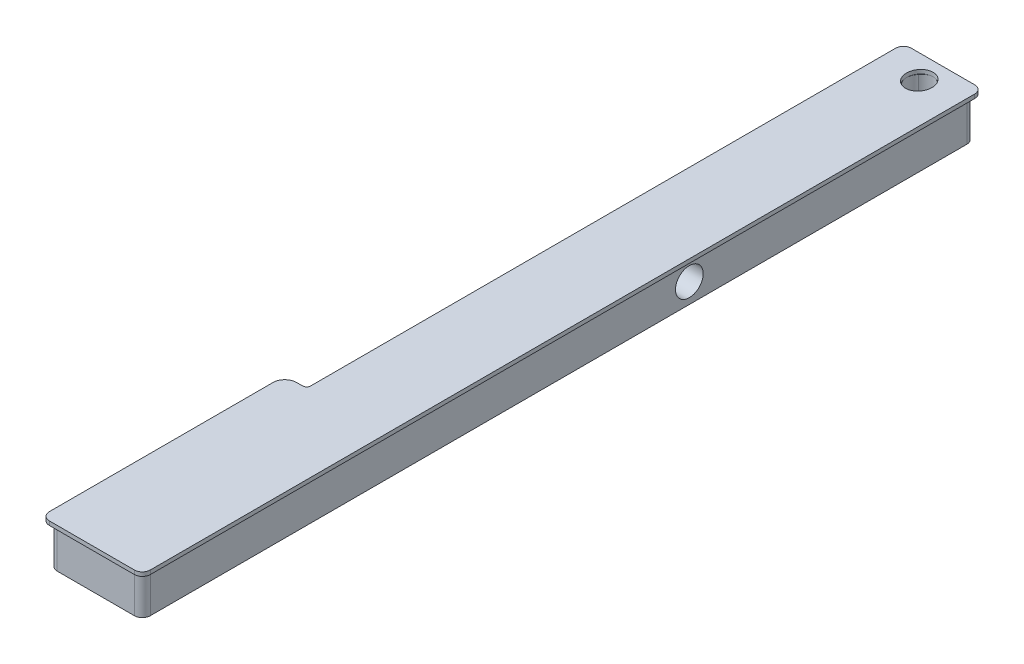
from build123d import *
from build123d.topology import SkipClean

# Parameters (mm, degrees)
BOSS_EXTRU_1_DEPTH       = 10
ESQUISSE2_RX             = 3.5
ESQUISSE2_RY             = 3
ENL_V_MAT_EXTRU_1_DEPTH  = 10
ESQUISSE3_R              = 3.2
ENL_V_MAT_EXTRU_2_DEPTH  = 10
ESQUISSE4_R              = 3.5
ENL_V_MAT_EXTRU_3_DEPTH  = 43
ESQUISSE6_W              = 25.48
ESQUISSE6_H              = 212
BOSS_EXTRU_2_DEPTH       = 1
CONG_1_R                 = 2
ENL_V_MAT_EXTRU_10_DEPTH = 10
CONG_4_R                 = 2
ENL_V_START              = -10
ESQUISSE14_R             = 3.2
ENL_V_MAT_EXTRU_11_DEPTH = 10
ESQUISSE16_RX            = 3.5
ESQUISSE16_RY            = 3.2
ENL_V_MAT_EXTRU_12_DEPTH = 10


with BuildPart() as part:
    # Esquisse1 → Boss.-Extru.1 (new body)
    with BuildSketch(Plane(origin=(0, 0, 0), x_dir=(1, 0, 0), z_dir=(0, 1, 0))):
        Polygon((11.344034618, -69), (-12.135965382, -69), (-12.135965382, -9.565866313), (-6.635965382, -9.565866313), (-6.635965382, 69), (-6.635965382, 141), (11.344034618, 141), (11.344034618, 69), align=None)
    extrude(amount=BOSS_EXTRU_1_DEPTH)

    # Esquisse2 → Enlèv. mat.-Extru.1 (cut)
    with BuildSketch(Plane(origin=(0, 10, 0), x_dir=(1, 0, 0), z_dir=(0, 1, 0))):
        with Locations(Location((2.354034618, 136), (0, 0, 90))):
            Ellipse(ESQUISSE2_RX, ESQUISSE2_RY)
    extrude(amount=-ENL_V_MAT_EXTRU_1_DEPTH, mode=Mode.SUBTRACT)

    # Esquisse3 → Enlèv. mat.-Extru.2 (cut)
    with BuildSketch(Plane(origin=(0, 10, 0), x_dir=(1, 0, 0), z_dir=(0, 1, 0))):
        with Locations((2.354034618, 136)):
            Circle(ESQUISSE3_R)
    extrude(amount=-ENL_V_MAT_EXTRU_2_DEPTH, mode=Mode.SUBTRACT)

    # Esquisse4 → Enlèv. mat.-Extru.3 (cut)
    with BuildSketch(Plane(origin=(11.344034618, 0, 0), x_dir=(0, 0, -1), z_dir=(1, 0, 0))):
        with Locations((69, 5)):
            Circle(ESQUISSE4_R)
    extrude(amount=-ENL_V_MAT_EXTRU_3_DEPTH, mode=Mode.SUBTRACT)

    # Esquisse6 → Boss.-Extru.2 (add)
    with BuildSketch(Plane(origin=(0, 10, 0), x_dir=(1, 0, 0), z_dir=(0, 1, 0))):
        with Locations((-0.395965382, 36)):
            Rectangle(ESQUISSE6_W, ESQUISSE6_H)
    extrude(amount=BOSS_EXTRU_2_DEPTH)

    # Congé1
    cong_1_edges = [part.edges().sort_by_distance(p)[0] for p in [
        (-6.635965382, 5, 9.565866313),
        (-6.635965382, 5, -141),
        (11.344034618, 5, -141),
        (11.344034618, 5, 69),
        (-12.135965382, 5, 69),
        (-12.135965382, 5, 9.565866313),
    ]]
    fillet(cong_1_edges, radius=CONG_1_R)

    # Esquisse8 → Enlèv. mat.-Extru.10 (cut)
    with BuildSketch(Plane(origin=(0, 10, 0), x_dir=(-1, 0, 0), z_dir=(0, -1, 0))):
        with BuildLine():
            Line((8.635965382, -8.565866313), (10.135965382, -8.565866313))
            ThreePointArc((10.135965382, -8.565866313), (12.257285726, -9.44454597), (13.135965382, -11.565866313))
            Line((13.135965382, -11.565866313), (13.142598636, -11.565866313))
            Line((13.142598636, -11.565866313), (13.142598636, 143.903740935))
            Line((13.142598636, 143.903740935), (7.635965382, 143.903740935))
            Line((7.635965382, 143.903740935), (7.635965382, -7.565866313))
            ThreePointArc((7.635965382, -7.565866313), (7.928858601, -8.272973094), (8.635965382, -8.565866313))
        make_face()
    extrude(amount=-ENL_V_MAT_EXTRU_10_DEPTH, mode=Mode.SUBTRACT)

    # Congé4
    cong_4_edges = [part.edges().sort_by_distance(p)[0] for p in [
        (-7.635965382, 10.5, -142),
        (12.344034618, 10.5, -142),
        (-13.135965382, 10.5, 70),
        (12.344034618, 10.5, 70),
    ]]
    fillet(cong_4_edges, radius=CONG_4_R)

    # Esquisse14 → Enlèv. mat.-Extru.11 (cut)
    with SkipClean():  # the faces are left unmerged after this step: merging them gives an invalid solid
        with BuildSketch(Plane(origin=(0, 10, 0), x_dir=(-1, 0, 0), z_dir=(0, -1, 0)).offset(ENL_V_START)):
            with Locations(Location((-2.354034618, 136, 0), (0, 0, 270))):
                Circle(ESQUISSE14_R)
        extrude(amount=ENL_V_MAT_EXTRU_11_DEPTH, mode=Mode.SUBTRACT)

    # Esquisse16 → Enlèv. mat.-Extru.12 (cut)
    with BuildSketch(Plane(origin=(0, 10, 0), x_dir=(-1, 0, 0), z_dir=(0, -1, 0))):
        with Locations(Location((-2.354034618, 136), (0, 0, -90))):
            Ellipse(ESQUISSE16_RX, ESQUISSE16_RY)
    extrude(amount=-ENL_V_MAT_EXTRU_12_DEPTH, mode=Mode.SUBTRACT)


solid = part.part
